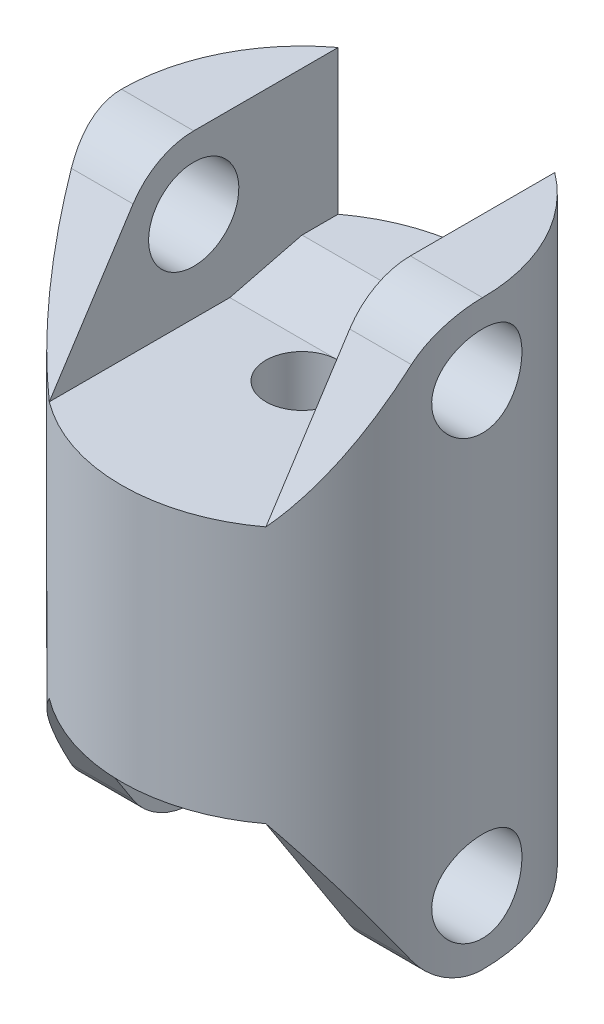
from build123d import *

# Parameters (mm, degrees)
SKETCH1_R               = 12.7
BOSS_EXTRUDE1_DEPTH     = 40.9448
CUT_EXTRUDE1_START      = -11.43
CUT_EXTRUDE1_DEPTH      = 11.43
CUT_EXTRUDE2_DEPTH      = 11.43
CUT_EXTRUDE3_DEPTH      = 48.441216753
CUT_EXTRUDE3_DEPTH_BACK = 48.441216753
SKETCH4_R               = 3.175
SKETCH5_R               = 2.54
CUT_EXTRUDE4_DEPTH      = 35.550013459
BOSS_EXTRUDE2_REACH     = 49.441
BOSS_EXTRUDE3_DEPTH     = 1.27


with BuildPart() as part:
    # Sketch1 → Boss-Extrude1 (new body)
    with BuildSketch(Plane(origin=(0, 0, 0), x_dir=(1, 0, 0), z_dir=(0, 1, 0))):
        with Locations(Location((0, 0, 0), (0, 0, 270))):
            Circle(SKETCH1_R)
    extrude(amount=BOSS_EXTRUDE1_DEPTH)

    # Sketch2 → Cut-Extrude1 (cut)
    with BuildSketch(Plane(origin=(0, 40.9448, 0), x_dir=(1, 0, 0), z_dir=(0, 1, 0)).offset(CUT_EXTRUDE1_START)):
        with BuildLine():
            Line((7.62, 10.16), (7.62, -10.16))
            ThreePointArc((7.62, -10.16), (0, -12.7), (-7.62, -10.16))
            Line((-7.62, -10.16), (-7.62, 10.16))
            ThreePointArc((-7.62, 10.16), (0, 12.7), (7.62, 10.16))
        make_face()
    extrude(amount=CUT_EXTRUDE1_DEPTH, mode=Mode.SUBTRACT)

    # Sketch3 → Cut-Extrude2 (cut)
    with BuildSketch(Plane.XZ):
        with BuildLine():
            Line((-7.62, 10.16), (-7.62, -10.16))
            ThreePointArc((-7.62, -10.16), (0, -12.7), (7.62, -10.16))
            Line((7.62, -10.16), (7.62, 10.16))
            ThreePointArc((7.62, 10.16), (0, 12.7), (-7.62, 10.16))
        make_face()
    extrude(amount=-CUT_EXTRUDE2_DEPTH, mode=Mode.SUBTRACT)

    # Sketch4 → Cut-Extrude3 (cut, two sides: drawn at the far end of the back side and taken through both)
    with BuildSketch(Plane(origin=(-7.62, 0, 0), x_dir=(0, 0, -1), z_dir=(1, 0, 0)).offset(-CUT_EXTRUDE3_DEPTH_BACK)):
        with Locations(Location((0, 35.8648, 0), (0, 0, 270))):
            Circle(SKETCH4_R)
        with Locations(Location((0, 5.08, 0), (0, 0, 270))):
            Circle(SKETCH4_R)
        with BuildLine():
            Line((0, 40.9448), (-10.16, 40.9448))
            Line((-10.16, 40.9448), (-10.16, 29.5148))
            Line((-10.16, 29.5148), (-4.264917923, 38.624668677))
            ThreePointArc((-4.264917923, 38.624668677), (-2.427577715, 40.327228312), (0, 40.9448))
        make_face()
        with BuildLine():
            Line((-4.264917923, 2.320131323), (-10.16, 11.43))
            Line((-10.16, 11.43), (-10.16, 0))
            Line((-10.16, 0), (0, 0))
            ThreePointArc((0, 0), (-2.427577715, 0.617571688), (-4.264917923, 2.320131323))
        make_face()
    extrude(amount=CUT_EXTRUDE3_DEPTH + CUT_EXTRUDE3_DEPTH_BACK, mode=Mode.SUBTRACT)

    # Sketch5 → Cut-Extrude4 (cut, through all)
    with BuildSketch(Plane(origin=(0, 29.5148, 0), x_dir=(1, 0, 0), z_dir=(0, 1, 0))):
        with Locations(Location((0, 0, 0), (0, 0, 270))):
            Circle(SKETCH5_R)
    extrude(amount=-CUT_EXTRUDE4_DEPTH, mode=Mode.SUBTRACT)

    # Boss-Extrude2: up to this face of the body (flat: up to its plane)
    boss_extrude2_end = Plane(part.part.faces().sort_by_distance((7.62, 29.747941009, 0))[0])
    # Sketch6 → Boss-Extrude2 (add, up to the picked face)
    with BuildSketch(Plane(origin=(-7.62, 0, 0), x_dir=(0, 0, -1), z_dir=(1, 0, 0)), mode=Mode.PRIVATE) as boss_extrude2_sk1:
        Polygon((2.54, 29.5148), (10.16, 29.5148), (10.16, 30.7848), (7.62, 30.7848), align=None)
    boss_extrude2_tool1 = split(extrude(boss_extrude2_sk1.sketch, amount=BOSS_EXTRUDE2_REACH, mode=Mode.PRIVATE), bisect_by=boss_extrude2_end, keep=Keep.BOTH, mode=Mode.PRIVATE)
    add(boss_extrude2_tool1.solids().sort_by(Axis((-7.62, 30.043967, -7.408333), (1, 0, 0)))[0])

    # Sketch7 → Boss-Extrude3 (add)
    with BuildSketch(Plane(origin=(0, 29.5148, 0), x_dir=(1, 0, 0), z_dir=(0, 1, 0))):
        with BuildLine():
            Line((-7.62, 10.16), (7.62, 10.16))
            ThreePointArc((7.62, 10.16), (0, 12.7), (-7.62, 10.16))
        make_face()
    extrude(amount=BOSS_EXTRUDE3_DEPTH)


solid = part.part
